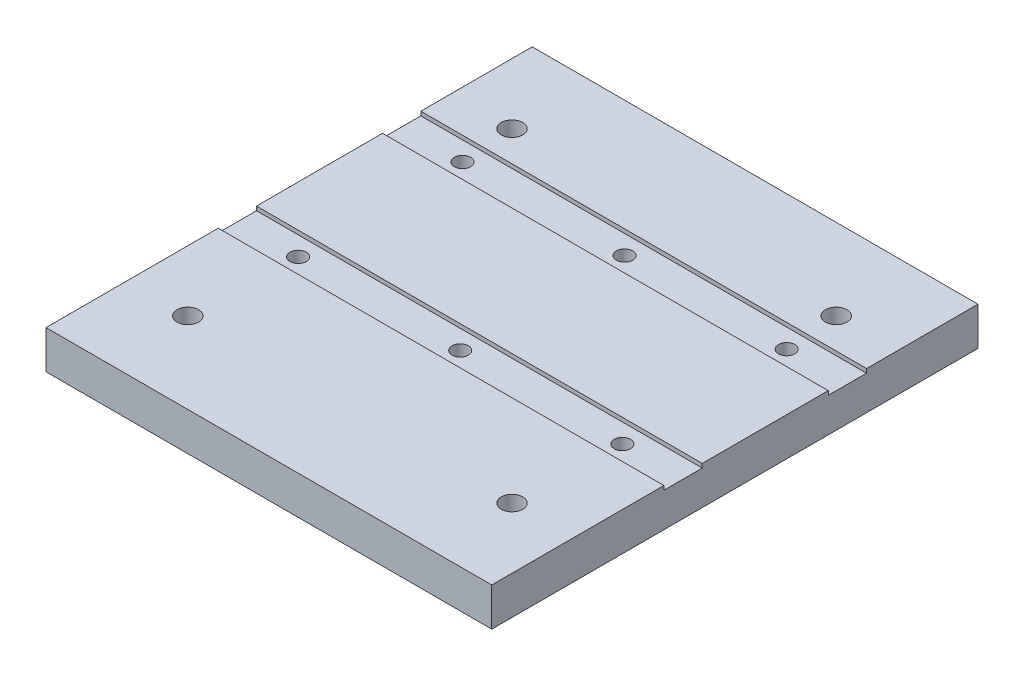
from build123d import *

# Parameters (mm, degrees)
SKETCH1_W                                       = 139.7
SKETCH1_H                                       = 152.4
BOSS_EXTRUDE1_DEPTH                             = 12
F_1_4_CLEARANCE_HOLE1_D                         = 6.7564
SKETCH8_W                                       = 139.7
SKETCH8_H                                       = 12
CUT_EXTRUDE2_DEPTH                              = 1.27
CBORE_FOR_10_SOCKET_HEAD_CAP_SCREW1_D           = 5.1054
CBORE_FOR_10_SOCKET_HEAD_CAP_SCREW1_CBORE_D     = 9.525
CBORE_FOR_10_SOCKET_HEAD_CAP_SCREW1_CBORE_DEPTH = 4.826


with BuildPart() as part:
    # Sketch1 → Boss-Extrude1 (new body)
    with BuildSketch(Plane(origin=(0, 0, 0), x_dir=(1, 0, 0), z_dir=(0, 1, 0))):
        Rectangle(SKETCH1_W, SKETCH1_H)
    extrude(amount=BOSS_EXTRUDE1_DEPTH)

    # 1/4 Clearance Hole1 (through all)
    with Locations(Plane(origin=(0, 12, 0), x_dir=(1, 0, 0), z_dir=(0, 1, 0))):
        with Locations((-50.8, 50.8), (50.8, 50.8), (50.8, -50.8), (-50.8, -50.8)):
            Hole(F_1_4_CLEARANCE_HOLE1_D / 2)

    # Sketch8 → Cut-Extrude2 (cut)
    with BuildSketch(Plane(origin=(0, 12, 0), x_dir=(1, 0, 0), z_dir=(0, 1, 0))):
        with Locations((0, 35.275)):
            Rectangle(SKETCH8_W, SKETCH8_H)
        with Locations((0, -16.225)):
            Rectangle(SKETCH8_W, SKETCH8_H)
    extrude(amount=-CUT_EXTRUDE2_DEPTH, mode=Mode.SUBTRACT)

    # CBORE for #10 Socket Head Cap Screw1 (through all)
    with Locations(Plane(origin=(0, 0, 0), x_dir=(-1, 0, 0), z_dir=(0, -1, 0))):
        with Locations((-50.8, 35.275), (0, 35.275), (50.8, 35.275), (50.8, -16.225), (0, -16.225), (-50.8, -16.225)):
            CounterBoreHole(CBORE_FOR_10_SOCKET_HEAD_CAP_SCREW1_D / 2, CBORE_FOR_10_SOCKET_HEAD_CAP_SCREW1_CBORE_D / 2, CBORE_FOR_10_SOCKET_HEAD_CAP_SCREW1_CBORE_DEPTH)


solid = part.part
